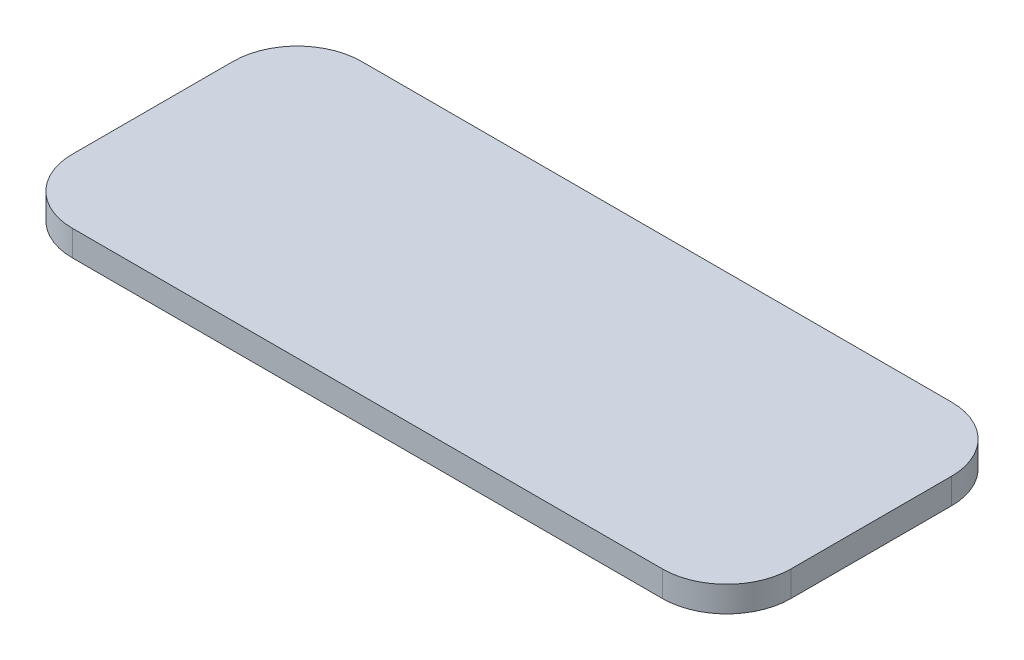
from build123d import *

# Parameters (mm, degrees)
BOSS_EXTRUDE1_DEPTH = 2


with BuildPart() as part:
    # Sketch2 → Boss-Extrude1 (new body)
    with BuildSketch(Plane(origin=(0, 0, 0), x_dir=(1, 0, 0), z_dir=(0, 1, 0))):
        with BuildLine():
            Line((-16.120868995, 4.031539822), (29.835019533, 4.031539822))
            ThreePointArc((29.835019533, 4.031539822), (33.370553438, 2.567073728), (34.835019533, -0.968460178))
            Line((34.835019533, -0.968460178), (34.835019533, -13.483291955))
            ThreePointArc((34.835019533, -13.483291955), (33.370553438, -17.018825861), (29.835019533, -18.483291955))
            Line((29.835019533, -18.483291955), (-16.120868995, -18.483291955))
            ThreePointArc((-16.120868995, -18.483291955), (-19.656402901, -17.018825861), (-21.120868995, -13.483291955))
            Line((-21.120868995, -13.483291955), (-21.120868995, -0.968460178))
            ThreePointArc((-21.120868995, -0.968460178), (-19.656402901, 2.567073728), (-16.120868995, 4.031539822))
        make_face()
    extrude(amount=BOSS_EXTRUDE1_DEPTH)


solid = part.part
